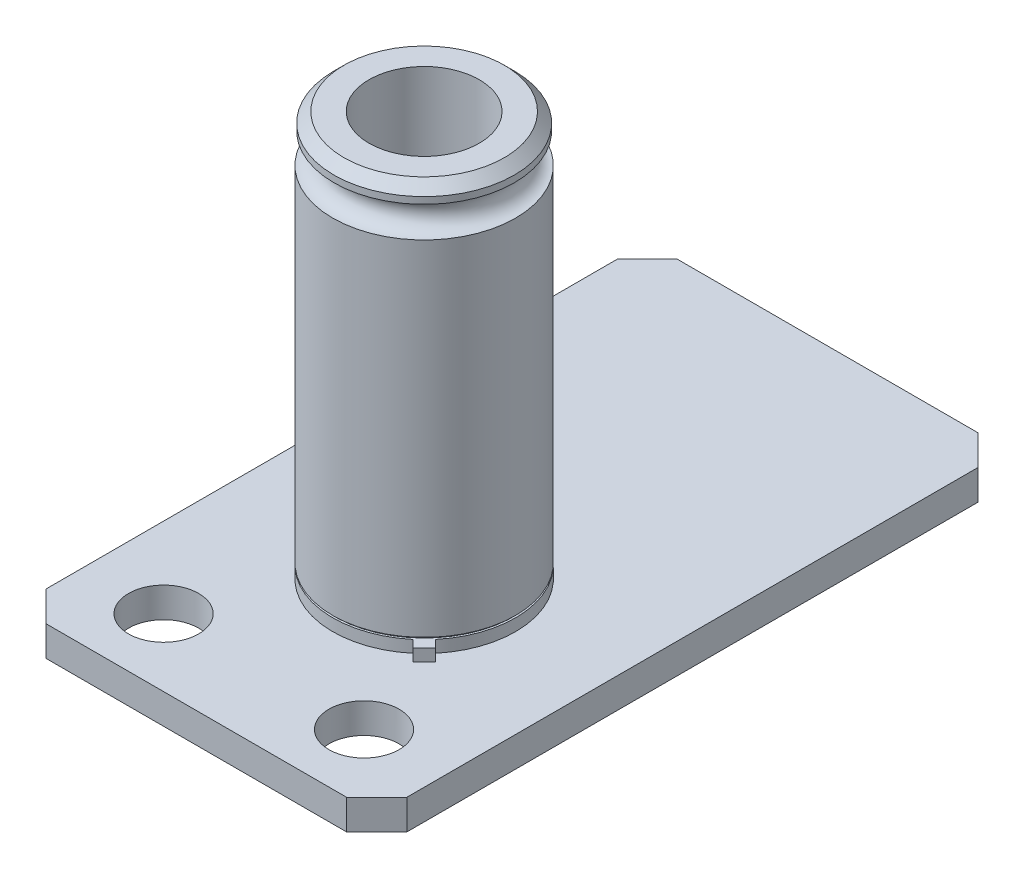
from build123d import *

# Parameters (mm, degrees)
SCHIZZO1_R                   = 4.56
ESTRUSIONE_ESTRUSIONE1_DEPTH = 19.5
SCHIZZO2_R                   = 0.75
SCHIZZO3_W                   = 2.392896604
SCHIZZO3_H                   = 1.50856525
SMUSSO1_SIZE                 = 0.5
FORO_PER_VITE_M5_1_D         = 5.5
ESTRUSIONE_ESTRUSIONE2_DEPTH = 0.6
SCHIZZO9_R                   = 0.8
TAGLIO_ESTRUSIONE1_DEPTH     = 0.6
SCHIZZO10_R                  = 0.225
ESTRUSIONE_ESTRUSIONE3_DEPTH = 13
Y_KSEKLIK_EKSTR_ZYON1_DEPTH  = 1.5
IZIM2_W                      = 6.442829969
IZIM2_H                      = 10.895192142
KES_EKSTR_ZYON1_DEPTH        = 13.5
IZIM3_R                      = 1.75
KES_EKSTR_ZYON2_DEPTH        = 13.5
KES_EKSTR_ZYON3_DEPTH        = 13.5


with BuildPart() as part:
    # Schizzo1 → Estrusione-Estrusione1 (new body)
    with BuildSketch(Plane(origin=(0, 0, 0), x_dir=(1, 0, 0), z_dir=(0, 1, 0))):
        with Locations(Location((0, 0, 0), (0, 0, 270))):
            Circle(SCHIZZO1_R)
    extrude(amount=ESTRUSIONE_ESTRUSIONE1_DEPTH)

    # Schizzo2 → Taglia-Rivoluzione1 (revolve, cut)
    with BuildSketch(Plane.XY, mode=Mode.PRIVATE) as taglia_rivoluzione1_sk:
        with Locations((-4.56, 17.92)):
            Circle(SCHIZZO2_R)
    revolve(taglia_rivoluzione1_sk.sketch.rotate(Axis((0, 19.5, 0), (0, -1, 0)), 270), axis=Axis((0, 19.5, 0), (0, -1, 0)), mode=Mode.SUBTRACT)

    # Schizzo3 → Taglia-Rivoluzione2 (revolve, cut)
    with BuildSketch(Plane.XY, mode=Mode.PRIVATE) as taglia_rivoluzione2_sk:
        with Locations((-5.696448302, 18.983195512)):
            Rectangle(SCHIZZO3_W, SCHIZZO3_H)
    revolve(taglia_rivoluzione2_sk.sketch.rotate(Axis((0, 19.5, 0), (0, -1, 0)), 270), axis=Axis((0, 19.5, 0), (0, -1, 0)), mode=Mode.SUBTRACT)

    # Smusso1
    smusso1_edges = [part.edges().sort_by_distance(p)[0] for p in [
        (0, 19.5, -4.5),
    ]]
    chamfer(smusso1_edges, length=SMUSSO1_SIZE)

    # Foro per Vite M5-1 (through all)
    with Locations(Plane.ZX.offset(19.5)):
        with Locations((0, 0)):
            Hole(FORO_PER_VITE_M5_1_D / 2)


with BuildPart() as body_2:
    # Schizzo7 → Rivoluzione1 (revolve)
    with BuildSketch(Plane.XY):
        Polygon((0, 0), (0, -0.7), (-4.56, -0.7), (-4.56, -0.1), (-4.46, -0.1), (-4.46, 0), align=None)
    revolve(axis=Axis((0, 0, 0), (0, -1, 0)))

    # Schizzo8 → Estrusione-Estrusione2 (add)
    with BuildSketch(Plane.XZ.offset(0.7)):
        Polygon((0.282842712, -0.282842712), (3.860803025, 3.2951176), (3.577960313, 3.577960313), (3.2951176, 3.860803025), (-0.282842712, 0.282842712), align=None)
    extrude(amount=-ESTRUSIONE_ESTRUSIONE2_DEPTH)

    # Schizzo9 → Taglio-Estrusione1 (cut)
    with BuildSketch(Plane.XZ.offset(0.7)):
        with Locations((2.54, 0)):
            Circle(SCHIZZO9_R)
        with Locations((0, -2.54)):
            Circle(SCHIZZO9_R)
        with Locations((-2.54, 0)):
            Circle(SCHIZZO9_R)
    extrude(amount=-TAGLIO_ESTRUSIONE1_DEPTH, mode=Mode.SUBTRACT)

    # Schizzo10 → Estrusione-Estrusione3 (add)
    with BuildSketch(Plane.XZ.offset(0.1)):
        with Locations((0, 2.54)):
            Circle(SCHIZZO10_R)
        with Locations(Location((2.54, 0, 0), (0, 0, 180))):
            Circle(SCHIZZO10_R)
        with Locations(Location((0, -2.54, 0), (0, 0, 180))):
            Circle(SCHIZZO10_R)
        with Locations(Location((-2.54, 0, 0), (0, 0, 180))):
            Circle(SCHIZZO10_R)
    extrude(amount=ESTRUSIONE_ESTRUSIONE3_DEPTH)

    # Çizim1 → Yükseklik-Ekstrüzyon1 (add)
    with BuildSketch(Plane(origin=(0, -0.7, 0), x_dir=(-1, 0, 0), z_dir=(0, -1, 0))):
        Polygon((-9, 11.367115911), (-9, -11.367115911), (9, -11.367115911), (9, 14.722710851), (9, 20.132884089), (-9, 20.132884089), align=None)
    extrude(amount=Y_KSEKLIK_EKSTR_ZYON1_DEPTH)

    # Çizim2 → Kes-Ekstrüzyon1 (cut)
    with BuildSketch(Plane.ZY.offset(9)):
        with Locations((0.288139048, -7.885150624)):
            Rectangle(IZIM2_W, IZIM2_H)
    extrude(amount=-KES_EKSTR_ZYON1_DEPTH, mode=Mode.SUBTRACT)

    # Çizim3 → Kes-Ekstrüzyon2 (cut)
    with BuildSketch(Plane(origin=(0, -0.7, 0), x_dir=(1, 0, 0), z_dir=(0, 1, 0))):
        with Locations(Location((-5, -8, 0), (0, 0, 180))):
            Circle(IZIM3_R)
        with Locations(Location((5, -8, 0), (0, 0, 180))):
            Circle(IZIM3_R)
    extrude(amount=-KES_EKSTR_ZYON2_DEPTH, mode=Mode.SUBTRACT)

    # Çizim4 → Kes-Ekstrüzyon3 (cut)
    with BuildSketch(Plane(origin=(0, -0.7, 0), x_dir=(1, 0, 0), z_dir=(0, 1, 0))):
        Polygon((-9, -9.867115911), (-7.5, -11.367115911), (-9, -11.367115911), align=None)
        Polygon((9, -11.367115911), (9, -9.867115911), (7.5, -11.367115911), align=None)
        Polygon((9, 18.632884089), (7.5, 20.132884089), (9, 20.132884089), align=None)
        Polygon((-9, 20.132884089), (-9, 18.632884089), (-7.5, 20.132884089), align=None)
    extrude(amount=-KES_EKSTR_ZYON3_DEPTH, mode=Mode.SUBTRACT)


solid = Compound([part.part, body_2.part])
